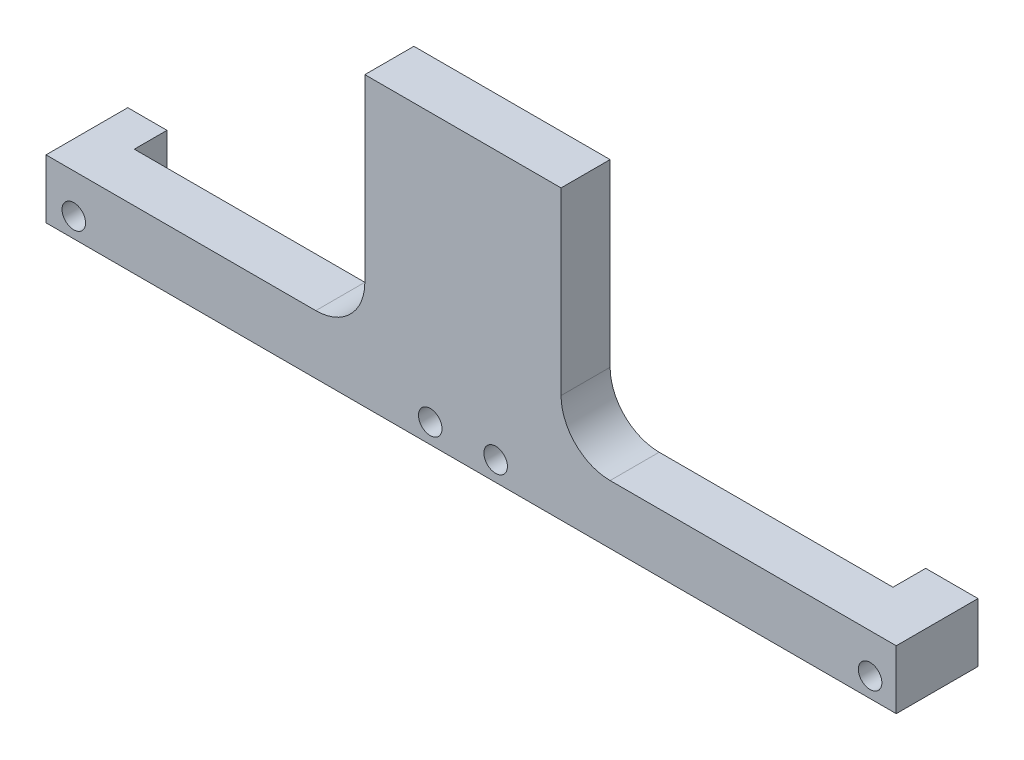
from build123d import *

# Parameters (mm, degrees)
SKETCH1_R               = 1.800000000000007
SKETCH1_R_2             = 1.7999999999999936
SKETCH1_R_3             = 1.8000000000000007
MOUNTING_FACE_DEPTH     = 7.5
CELL_SUPPORT_FILLETS_R  = 7.5
MIDLINE_START           = 5
SKETCH3_W               = 8
SKETCH3_H               = 8.999999999999991
SKETCH3_R               = 1.8000000000000007
SKETCH3_R_2             = 1.7999999999999936
MIDLINE_EXTENSION_DEPTH = 5


with BuildPart() as part:
    # Sketch1 → Mounting Face (new body)
    with BuildSketch(Plane.XY):
        Polygon((0, 8.999999999999991), (0, 0), (-129.99999999999983, 0), (-129.99999999999983, 9), (-81.24999999999999, 9), (-81.24999999999999, 44), (-51.24999999999999, 44), (-51.24999999999999, 8.999999999999991), align=None)
        with Locations((-125.75, 3)):
            Circle(SKETCH1_R, mode=Mode.SUBTRACT)
        with Locations((-71.25, 3)):
            Circle(SKETCH1_R_2, mode=Mode.SUBTRACT)
        with Locations((-61.25, 3)):
            Circle(SKETCH1_R_2, mode=Mode.SUBTRACT)
        with Locations((-4.000000000000001, 3)):
            Circle(SKETCH1_R_3, mode=Mode.SUBTRACT)
    extrude(amount=MOUNTING_FACE_DEPTH)

    # Cell Support Fillets
    cell_support_fillets_edges = [part.edges().sort_by_distance(p)[0] for p in [
        (-51.24999999999999, 8.999999999999991, 3.75),
        (-81.24999999999999, 9, 3.75),
    ]]
    fillet(cell_support_fillets_edges, radius=CELL_SUPPORT_FILLETS_R)

    # Sketch3 → Midline Extension (add)
    # profile 1 of 3: a face of its own
    with BuildSketch(Plane(origin=(0, 0, 0), x_dir=(-1, 0, 0), z_dir=(0, 0, -1)).offset(MIDLINE_START)):
        with BuildLine():
            Line((129.99999999999983, 0), (123.99999999999983, -7.3e-16))
            Line((123.99999999999983, -7.3e-16), (123.99999999999983, 2.578692511341897))
            ThreePointArc((123.99999999999983, 2.578692511341897), (127.55, 2.999999999999978), (123.99999999999983, 3.421307488658149))
            Line((123.99999999999983, 3.421307488658149), (123.99999999999983, 9))
            Line((123.99999999999983, 9), (129.99999999999983, 9))
            Line((129.99999999999983, 9), (129.99999999999983, 0))
        make_face()
    # profile 2 of 3: a face of its own
    with BuildSketch(Plane(origin=(0, 0, 0), x_dir=(-1, 0, 0), z_dir=(0, 0, -1)).offset(MIDLINE_START)):
        with Locations((4, 4.499999999999996)):
            Rectangle(SKETCH3_W, SKETCH3_H)
        with Locations((4.000000000000001, 3)):
            Circle(SKETCH3_R, mode=Mode.SUBTRACT)
    # profile 3 of 3: a face of its own
    with BuildSketch(Plane(origin=(0, 0, 0), x_dir=(-1, 0, 0), z_dir=(0, 0, -1)).offset(MIDLINE_START)):
        Polygon((56.24999999999999, 0), (76.25, 0), (76.25, 6), (56.25, 6), align=None)
        with Locations((61.25, 3)):
            Circle(SKETCH3_R_2, mode=Mode.SUBTRACT)
        with Locations((71.25, 3)):
            Circle(SKETCH3_R_2, mode=Mode.SUBTRACT)
    extrude(amount=-MIDLINE_EXTENSION_DEPTH)


solid = part.part
